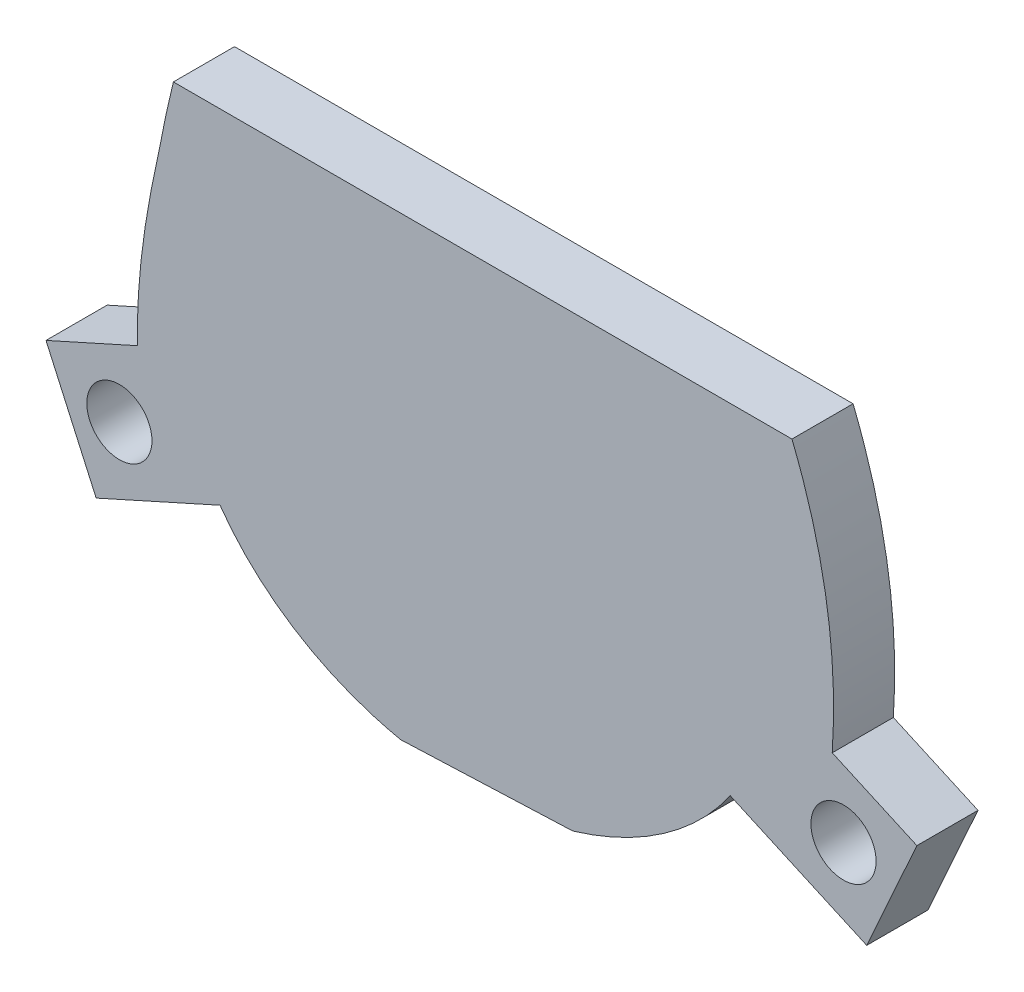
from build123d import *

# Parameters (mm, degrees)
BOSS_EXTRUDE1_START = -2
SKETCH1_R           = 0.8
BOSS_EXTRUDE1_DEPTH = 1.5


with BuildPart() as part:
    # Sketch1 → Boss-Extrude1 (new body)
    with BuildSketch(Plane.XY.offset(BOSS_EXTRUDE1_START)):
        with BuildLine():
            Line((7.571676853, 3.903865442), (6.416086079, 3.903865442))
            Line((6.416086079, 3.903865442), (-6.281037731, 3.903865442))
            Line((-6.281037731, 3.903865442), (-7.609270418, 3.903865442))
            add(Edge.make_bspline(
                [(-7.95528082, 2.295104415), (-7.850615408, 2.833585734), (-7.745718452, 3.376152559), (-7.609270418, 3.903865442)],
                knots=[0.598753878, 0.598753878, 0.598753878, 0.598753878, 0.708182049, 0.708182049, 0.708182049, 0.708182049], degree=3))
            add(Edge.make_bspline(
                [(-8.491604222, -2.143861632), (-8.497541628, -1.753055168), (-8.461188827, -0.260180468), (-8.197652692, 1.215784612), (-7.95528082, 2.295104415)],
                knots=[0.5931491, 0.5931491, 0.5931491, 0.5931491, 0.658813679, 0.84412355, 0.84412355, 0.84412355, 0.84412355], degree=3))
            Line((-8.491604222, -2.143861632), (-10.735900357, -3.15355335))
            Line((-10.735900357, -3.15355335), (-9.505051186, -5.889428039))
            Line((-9.505051186, -5.889428039), (-6.464679246, -4.521557259))
            add(Edge.make_bspline(
                [(-6.464679246, -4.521557259), (-4.951547414, -6.675350117), (-2.029321492, -7.287998666)],
                knots=[0.510655247, 0.510655247, 0.510655247, 1.302217681, 1.302217681, 1.302217681], degree=2, weights=[1, 0.922695664, 1]))
            Line((-2.029321492, -7.287998666), (2.191128147, -7.117218369))
            add(Edge.make_bspline(
                [(2.191128147, -7.117218369), (4.720940331, -6.365516028), (6.056108453, -4.433151977)],
                knots=[1.895445663, 1.895445663, 1.895445663, 2.606320009, 2.606320009, 2.606320009], degree=2, weights=[1, 0.937494442, 1]))
            Line((6.056108453, -4.433151977), (9.406785059, -5.940595847))
            Line((9.406785059, -5.940595847), (10.637634232, -3.204721158))
            Line((10.637634232, -3.204721158), (8.560362384, -2.270172384))
            add(Edge.make_bspline(
                [(8.560362384, -2.270172384), (8.775779374, 0.923139429), (7.571676853, 3.903865442)],
                knots=[0, 0, 0, 1, 1, 1], degree=2))
        make_face()
        with Locations((8.836663947, -4.039290527)):
            Circle(SKETCH1_R, mode=Mode.SUBTRACT)
        with Locations((-8.934930071, -3.988122724)):
            Circle(SKETCH1_R, mode=Mode.SUBTRACT)
    extrude(amount=-BOSS_EXTRUDE1_DEPTH)


solid = part.part
